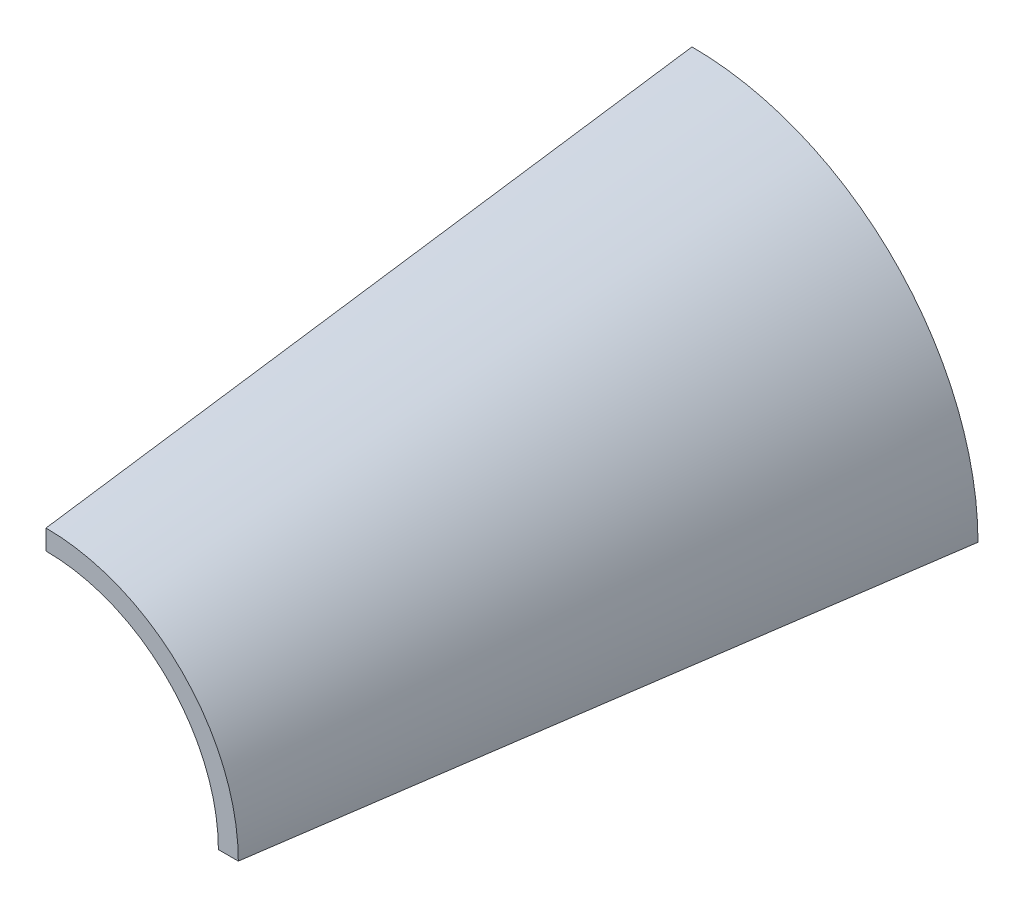
from build123d import *

# Parameters (mm, degrees)
RIVOLUZIONE1_ANGLE = 90


with BuildPart() as part:
    # Schizzo1 → Rivoluzione1 (revolve)
    with BuildSketch(Plane(origin=(0, 0, 0), x_dir=(0, 0, -1), z_dir=(1, 0, 0))):
        Polygon((-6550, 1950), (-6550, 1747.907341038), (0, 2697.907341038), (0, 2900), align=None)
    revolve(axis=Axis((0, 0, 6550), (0, 0, -1)), revolution_arc=RIVOLUZIONE1_ANGLE)


solid = part.part
